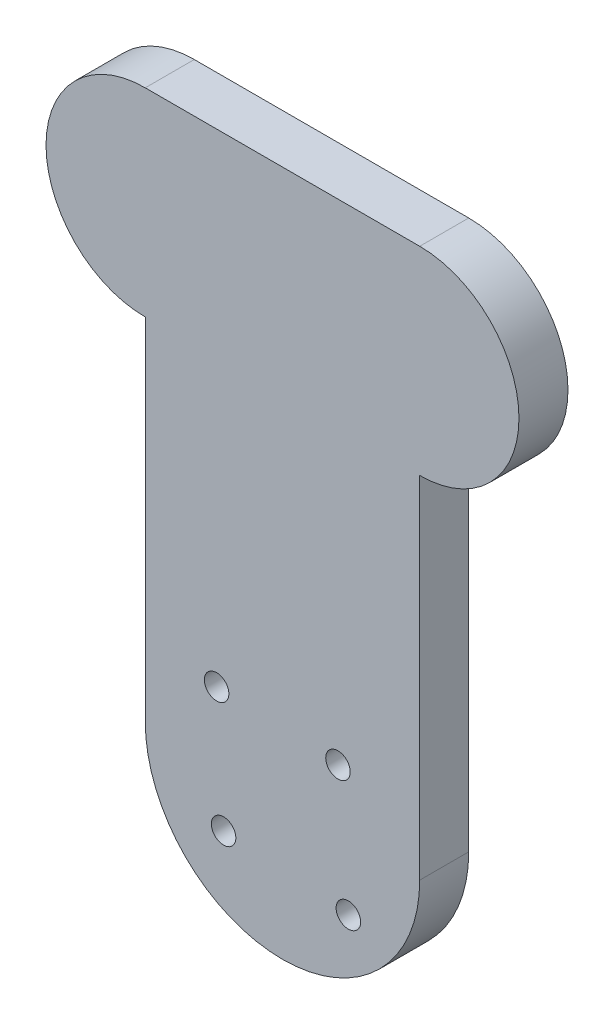
from build123d import *

# Parameters (mm, degrees)
SKETCH1_R           = 1.25
BOSS_EXTRUDE1_DEPTH = 5


with BuildPart() as part:
    # Sketch1 → Boss-Extrude1 (new body)
    with BuildSketch(Plane.XY):
        with BuildLine():
            Line((-14, 0), (-14, 35.752157845))
            ThreePointArc((-14, 35.752157845), (-24.124447597, 45.876605442), (-14, 56.001053039))
            Line((-14, 56.001053039), (14, 56.001053039))
            ThreePointArc((14, 56.001053039), (24.124447597, 45.876605442), (14, 35.752157845))
            Line((14, 35.752157845), (14, 0))
            ThreePointArc((14, 0), (0, -14), (-14, 0))
        make_face()
        with Locations((6.72, -6.72)):
            Circle(SKETCH1_R, mode=Mode.SUBTRACT)
        with Locations((-6.01, -5.66)):
            Circle(SKETCH1_R, mode=Mode.SUBTRACT)
        with Locations(Location((5.66, 6.01, 0), (0, 0, 180))):
            Circle(SKETCH1_R, mode=Mode.SUBTRACT)
        with Locations(Location((-6.72, 6.72, 0), (0, 0, 180))):
            Circle(SKETCH1_R, mode=Mode.SUBTRACT)
    extrude(amount=BOSS_EXTRUDE1_DEPTH)


solid = part.part
